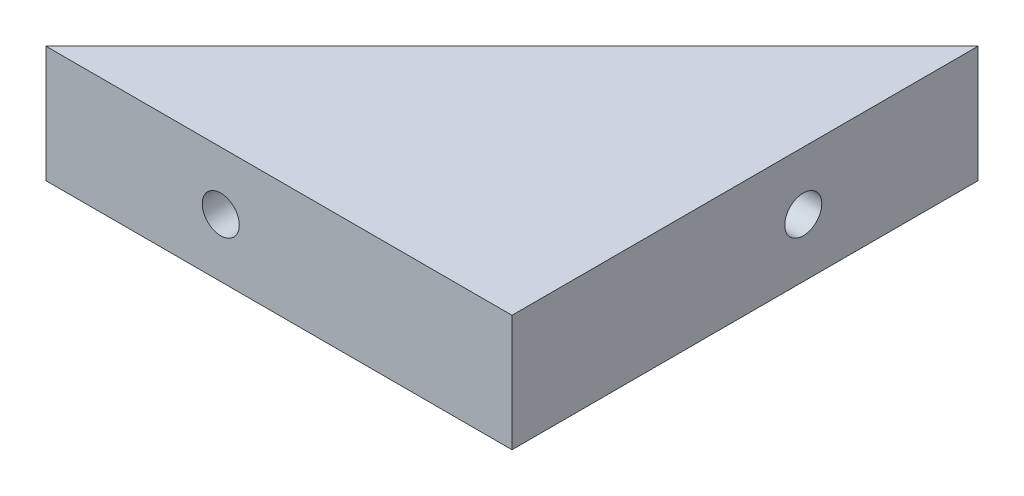
from build123d import *

# Parameters (mm, degrees)
BOSS_EXTRUDE1_DEPTH        = 12.7
F_10_32_TAPPED_HOLE1_D     = 4.0386
F_10_32_TAPPED_HOLE1_DEPTH = 25.4
F_10_32_TAPPED_HOLE1_TIP   = 1.213317848
F_10_32_TAPPED_HOLE2_D     = 4.0386
F_10_32_TAPPED_HOLE2_DEPTH = 25.4
F_10_32_TAPPED_HOLE2_TIP   = 1.213317848


with BuildPart() as part:
    # Sketch1 → Boss-Extrude1 (new body)
    with BuildSketch(Plane(origin=(0, 0, 0), x_dir=(1, 0, 0), z_dir=(0, 1, 0))):
        Polygon((-25.4, -25.4), (25.4, 25.4), (25.4, -25.4), align=None)
    extrude(amount=BOSS_EXTRUDE1_DEPTH)

    # #10-32 Tapped Hole1
    with Locations(Plane(origin=(25.4, 0, 0), x_dir=(0, 0, -1), z_dir=(1, 0, 0))):
        with Locations((6.35, 6.35)):
            Hole(F_10_32_TAPPED_HOLE1_D / 2, depth=F_10_32_TAPPED_HOLE1_DEPTH)
            with Locations((0, 0, -(F_10_32_TAPPED_HOLE1_DEPTH + F_10_32_TAPPED_HOLE1_TIP / 2))):  # 118° drill point
                Cone(0, F_10_32_TAPPED_HOLE1_D / 2, F_10_32_TAPPED_HOLE1_TIP, mode=Mode.SUBTRACT)

    # #10-32 Tapped Hole2
    with Locations(Plane.XY.offset(25.4)):
        with Locations((-6.35, 6.35)):
            Hole(F_10_32_TAPPED_HOLE2_D / 2, depth=F_10_32_TAPPED_HOLE2_DEPTH)
            with Locations((0, 0, -(F_10_32_TAPPED_HOLE2_DEPTH + F_10_32_TAPPED_HOLE2_TIP / 2))):  # 118° drill point
                Cone(0, F_10_32_TAPPED_HOLE2_D / 2, F_10_32_TAPPED_HOLE2_TIP, mode=Mode.SUBTRACT)


solid = part.part
